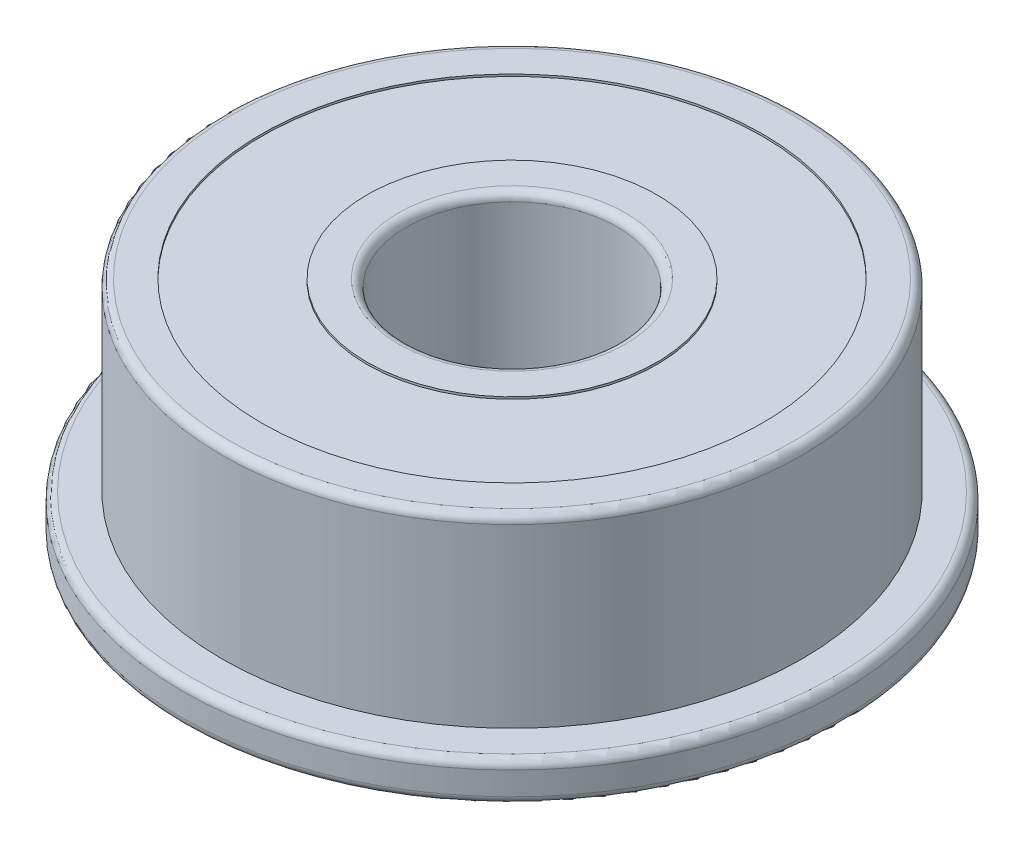
from build123d import *

# Parameters (mm, degrees)
SKETCH1_R           = 12.5
BOSS_EXTRUDE1_DEPTH = 1.5
SKETCH2_R           = 11
BOSS_EXTRUDE2_DEPTH = 7
SKETCH3_R           = 4
CUT_EXTRUDE1_DEPTH  = 20.615045246
SKETCH4_R           = 9.5
SKETCH4_R_2         = 5.5
CUT_EXTRUDE2_DEPTH  = 0.08
CUT_EXTRUDE3_START  = -0.08
SKETCH5_R           = 9.5
SKETCH5_R_2         = 5.5
CUT_EXTRUDE3_DEPTH  = 0.08
FILLET1_R           = 0.31


with BuildPart() as part:
    # Sketch1 → Boss-Extrude1 (new body)
    with BuildSketch(Plane(origin=(0, 0, 0), x_dir=(1, 0, 0), z_dir=(0, 1, 0))):
        with Locations(Location((0, 0, 0), (0, 0, 270))):
            Circle(SKETCH1_R)
    extrude(amount=BOSS_EXTRUDE1_DEPTH)

    # Sketch2 → Boss-Extrude2 (add)
    with BuildSketch(Plane(origin=(0, 1.5, 0), x_dir=(1, 0, 0), z_dir=(0, 1, 0))):
        with Locations(Location((0, 0, 0), (0, 0, 270))):
            Circle(SKETCH2_R)
    extrude(amount=BOSS_EXTRUDE2_DEPTH)

    # Sketch3 → Cut-Extrude1 (cut, through all)
    with BuildSketch(Plane(origin=(0, 8.5, 0), x_dir=(1, 0, 0), z_dir=(0, 1, 0))):
        with Locations(Location((0, 0, 0), (0, 0, 270))):
            Circle(SKETCH3_R)
    extrude(amount=-CUT_EXTRUDE1_DEPTH, mode=Mode.SUBTRACT)

    # Sketch4 → Cut-Extrude2 (cut)
    with BuildSketch(Plane.XZ):
        with Locations(Location((0, 0, 0), (0, 0, 270))):
            Circle(SKETCH4_R)
        with Locations(Location((0, 0, 0), (0, 0, 270))):
            Circle(SKETCH4_R_2, mode=Mode.SUBTRACT)
    extrude(amount=-CUT_EXTRUDE2_DEPTH, mode=Mode.SUBTRACT)

    # Sketch5 → Cut-Extrude3 (cut)
    with BuildSketch(Plane(origin=(0, 8.5, 0), x_dir=(1, 0, 0), z_dir=(0, 1, 0)).offset(CUT_EXTRUDE3_START)):
        with Locations(Location((0, 0, 0), (0, 0, 90))):
            Circle(SKETCH5_R)
        with Locations(Location((0, 0, 0), (0, 0, 90))):
            Circle(SKETCH5_R_2, mode=Mode.SUBTRACT)
    extrude(amount=CUT_EXTRUDE3_DEPTH, mode=Mode.SUBTRACT)

    # Fillet1
    fillet1_edges = [part.edges().sort_by_distance(p)[0] for p in [
        (0, 0, -4),
        (0, 8.5, -4),
        (0, 0, -12.5),
        (0, 1.5, -12.5),
        (0, 8.5, -11),
    ]]
    fillet(fillet1_edges, radius=FILLET1_R)


solid = part.part
